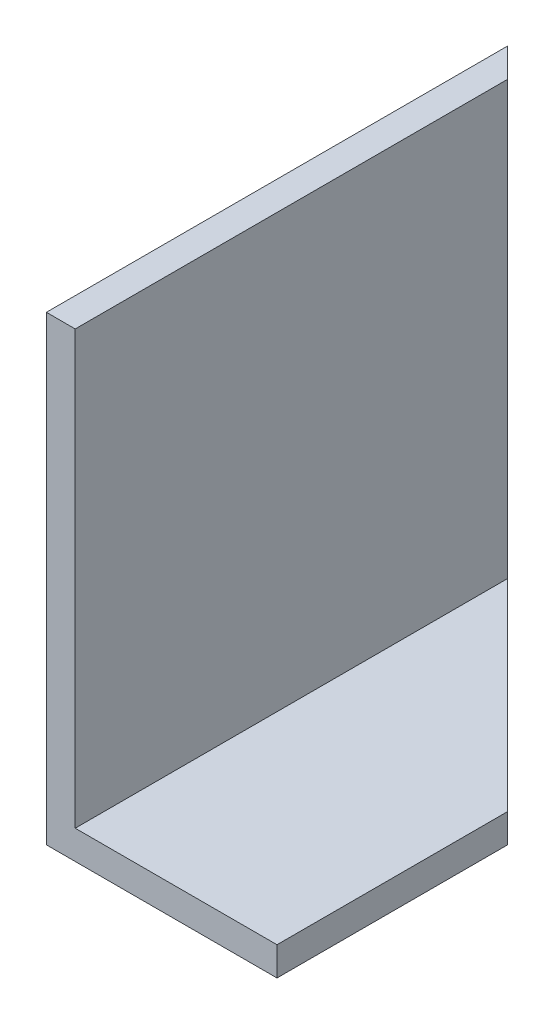
from build123d import *

# Parameters (mm, degrees)
BOSS_EXTRUDE1_DEPTH = 50.8
CUT_EXTRUDE4_DEPTH  = 73.955945611


with BuildPart() as part:
    # Sketch1 → Boss-Extrude1 (new body)
    with BuildSketch(Plane.XY):
        Polygon((-9.525, -22.225), (12.7, -22.225), (12.7, -25.4), (-12.7, -25.4), (-12.7, 25.4), (-9.525, 25.4), align=None)
    extrude(amount=BOSS_EXTRUDE1_DEPTH)

    # Sketch6 → Cut-Extrude4 (cut, through all)
    with BuildSketch(Plane.XZ.offset(25.4)):
        Polygon((-12.7, 0), (12.7, 25.4), (12.7, 0), align=None)
    extrude(amount=-CUT_EXTRUDE4_DEPTH, mode=Mode.SUBTRACT)


solid = part.part
